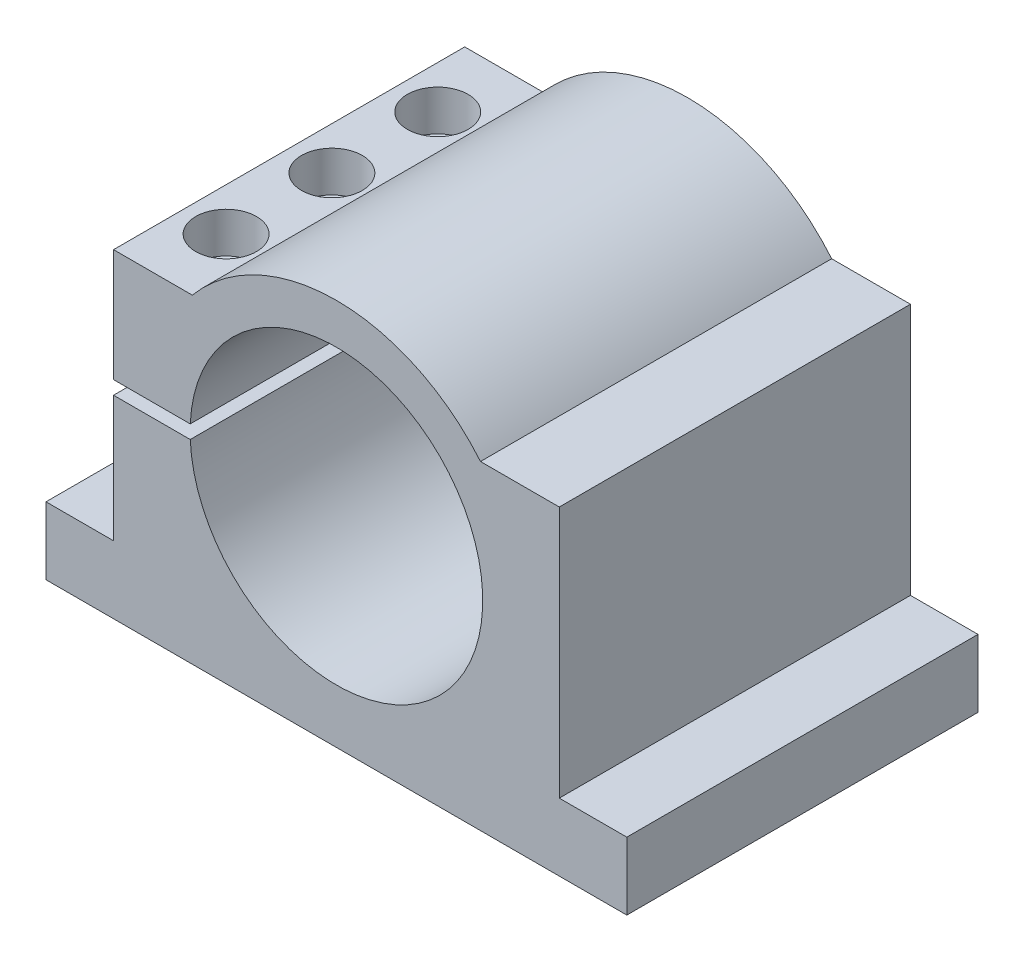
from build123d import *

# Parameters (mm, degrees)
EXTRUDE_1_DEPTH        = 78
PATTERN_LINEAR_1_COUNT = 3
PATTERN_LINEAR_1_PITCH = 23.5
SKETCH_26_W            = 4.5
SKETCH_26_H            = 40
M8X1_257_D             = 6.8
M8X1_257_DEPTH         = 14.41228676


with BuildPart() as part:
    # Эскиз1 → Бобышка-Вытянуть1 (new body)
    with BuildSketch(Plane.XY):
        with BuildLine():
            Line((-64.5, 0), (64.5, 0))
            Line((64.5, 0), (64.5, 15))
            Line((64.5, 15), (49.5, 15))
            Line((49.5, 15), (49.5, 71))
            Line((49.5, 71), (32, 71))
            ThreePointArc((32, 71), (0, 86), (-32, 71))
            Line((-32, 71), (-49.5, 71))
            Line((-49.5, 71), (-49.5, 46))
            Line((-49.5, 46), (-32.465366161, 46))
            ThreePointArc((-32.465366161, 46), (32.5, 44.5), (-32.465366161, 43))
            Line((-32.465366161, 43), (-49.5, 43))
            Line((-49.5, 43), (-49.5, 15))
            Line((-49.5, 15), (-64.5, 15))
            Line((-64.5, 15), (-64.5, 0))
        make_face()
    extrude(amount=EXTRUDE_1_DEPTH)

    # Эскиз14 → Вырез-Повернуть2 (revolve, cut)
    with BuildSketch(Plane.ZY.offset(40), mode=Mode.PRIVATE) as cut_revolve_2_sk:
        Polygon((55.75, 62), (55.75, 71), (62.5, 71), (62.5, 60.41228676), (58.5, 60.41228676), align=None)
    cut_revolve_2 = revolve(cut_revolve_2_sk.sketch.rotate(Axis((-40, 71, 62.5), (0, -1, 0)), 180), axis=Axis((-40, 71, 62.5), (0, -1, 0)), mode=Mode.SUBTRACT)

    # Линейный массив1: Вырез-Повернуть2 ×3
    with Locations(*[(0, 0, -i * PATTERN_LINEAR_1_PITCH) for i in range(1, PATTERN_LINEAR_1_COUNT)]):
        add(cut_revolve_2, mode=Mode.SUBTRACT)

    # Эскиз24 → Отверстие обработанное метчиком M8x1.254 (revolve, cut)
    with BuildSketch(Plane(origin=(-40, 43, 62.5), x_dir=(0, 0, 1), z_dir=(1, 0, 0))):
        Polygon((0, 0), (0, 27.042926105), (3.4, 25), (3.4, 0), align=None)
    m8x1_254 = revolve(axis=Axis((-40, 49.35, 62.5), (0, -1, 0)), mode=Mode.SUBTRACT)

    # Эскиз26 → Диаметр отверстия Ø9.0 (9)2 (revolve, cut)
    with BuildSketch(Plane(origin=(-40, 46, 62.5), x_dir=(0, 0, -1), z_dir=(1, 0, 0))):
        with Locations((2.25, 20)):
            Rectangle(SKETCH_26_W, SKETCH_26_H)
    hole_wizard_9_0_9_2 = revolve(axis=Axis((-40, 39.65, 62.5), (0, 1, 0)), mode=Mode.SUBTRACT)

    # Отверстие обработанное метчиком M8x1.257
    with Locations(Plane(origin=(0, 60.41228676, 0), x_dir=(1, 0, 0), z_dir=(0, 1, 0))):
        with Locations((-40, -39)):
            Hole(M8X1_257_D / 2, depth=M8X1_257_DEPTH)

    # Зеркальное отражение1: Отверстие обработанное метчиком M8x1.254, Диаметр отверстия Ø9.0 (9)2 across plane
    add(m8x1_254.mirror(Plane.XY.offset(39)), mode=Mode.SUBTRACT)
    add(hole_wizard_9_0_9_2.mirror(Plane.XY.offset(39)), mode=Mode.SUBTRACT)


solid = part.part
